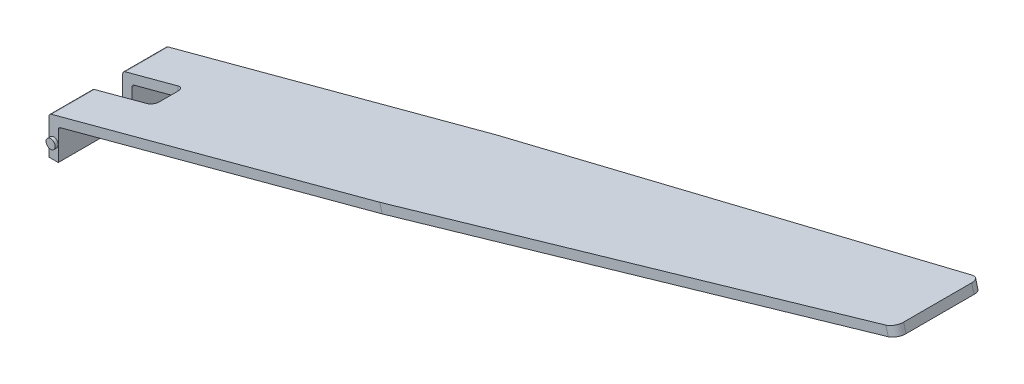
from build123d import *

# Parameters (mm, degrees)
PROFILE_EXTRUDE_DEPTH   = 3.8
CHAMFER_TOP_SIZE        = 0.5
CHAMFER_TOP_SIZE2       = 16.846754467
PINS_EXTRUDE_DEPTH      = 0.1
PINS_EXTRUDE_DEPTH_BACK = 3.9
SKETCH3_R               = 0.15
SLOT_SKETCH_W           = 2
SLOT_SKETCH_H           = 1
SLOT_CUT_DEPTH          = 10
FILLET1_R               = 0.1
FILLET2_R               = 0.3
FILLET3_R               = 0.2


with BuildPart() as part:
    # Profile Sketch → Profile Extrude (new body)
    with BuildSketch(Plane.XY):
        Polygon((0, 0), (0, 1.230198096), (27.045923136, 8.477131359), (27.12356885, 8.187353611), (0.3, 1), (0.3, 0), align=None)
    extrude(amount=PROFILE_EXTRUDE_DEPTH)

    # Chamfer Top
    chamfer_top_edges = [part.edges().sort_by_distance(p)[0] for p in [
        (27.084745993, 8.332242485, 3.8),
        (27.084745993, 8.332242485, 0),
    ]]
    chamfer_top_side = [part.faces().sort_by_distance(p)[0] for p in [
        (27.084745993, 8.332242485, 1.9),
    ]]
    chamfer(chamfer_top_edges, length=CHAMFER_TOP_SIZE, length2=CHAMFER_TOP_SIZE2, reference=chamfer_top_side[0])

    # Sketch3 → Pins Extrude (add, two sides: drawn at the far end of the back side and taken through both)
    with BuildSketch(Plane.XY.offset(3.8).offset(-PINS_EXTRUDE_DEPTH_BACK)):
        with Locations((0.15, 0.5)):
            Circle(SKETCH3_R)
    extrude(amount=PINS_EXTRUDE_DEPTH + PINS_EXTRUDE_DEPTH_BACK)

    # Slot Sketch → Slot Cut (cut)
    with BuildSketch(Plane.XZ):
        with Locations((1, 1.9)):
            Rectangle(SLOT_SKETCH_W, SLOT_SKETCH_H)
    extrude(amount=-SLOT_CUT_DEPTH, mode=Mode.SUBTRACT)

    # Fillet1
    fillet1_edges = [part.edges().sort_by_distance(p)[0] for p in [
        (0, 1.230198096, 3.1),
        (0.3, 1, 3.1),
        (0, 1.230198096, 0.7),
        (0.3, 1, 0.7),
    ]]
    fillet(fillet1_edges, radius=FILLET1_R)

    # Fillet2
    fillet2_edges = [part.edges().sort_by_distance(p)[0] for p in [
        (27.084745993, 8.332242485, 0.5),
        (27.084745993, 8.332242485, 3.3),
    ]]
    fillet(fillet2_edges, radius=FILLET2_R)

    # Fillet3
    fillet3_edges = [part.edges().sort_by_distance(p)[0] for p in [
        (2, 1.610805054, 2.4),
        (2, 1.610805054, 1.4),
    ]]
    fillet(fillet3_edges, radius=FILLET3_R)


solid = part.part
